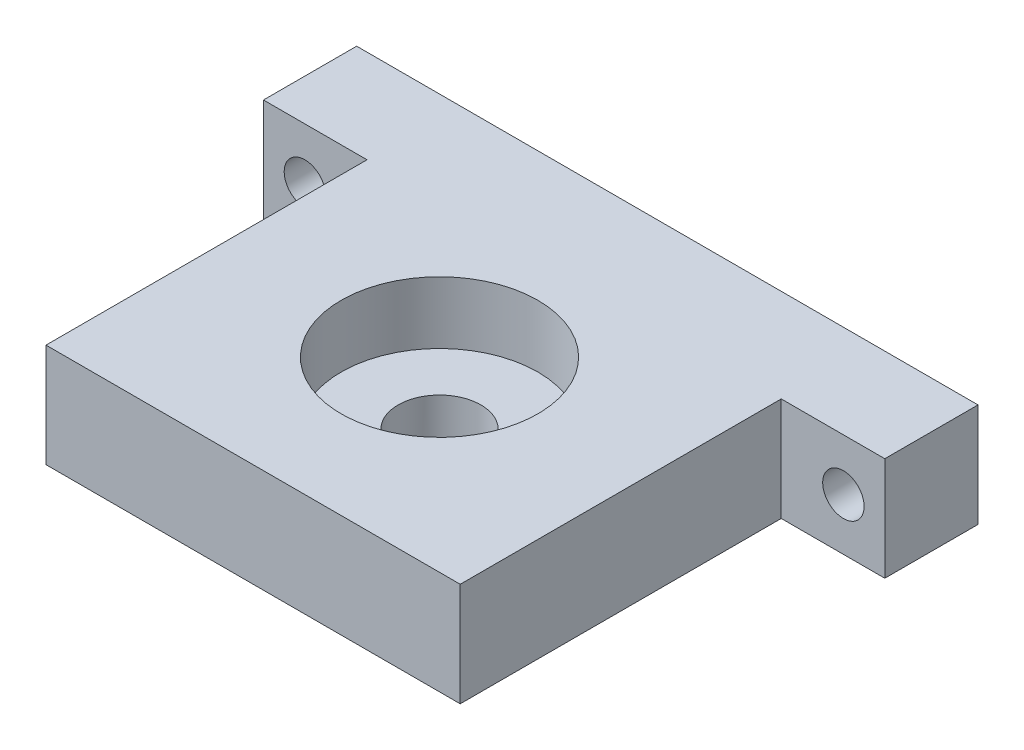
from build123d import *

# Parameters (mm, degrees)
BOSS_EXTRUDE1_DEPTH     = 10
CUT_EXTRUDE1_DEPTH      = 38.416573868
CUT_EXTRUDE1_DEPTH_BACK = 6
SKETCH3_R               = 9.5
SKETCH4_R               = 4
CUT_EXTRUDE2_DEPTH      = 10
CUT_EXTRUDE3_DEPTH      = 51.990195136
CUT_EXTRUDE3_DEPTH_BACK = 51.990195136
SKETCH5_R               = 2


with BuildPart() as part:
    # Sketch1 → Boss-Extrude1 (new body)
    with BuildSketch(Plane(origin=(0, 0, 0), x_dir=(1, 0, 0), z_dir=(0, 1, 0))):
        Polygon((-20, -20), (20, -20), (20, 11), (30, 11), (30, 20), (20, 20), (-20, 20), (-30, 20), (-30, 11), (-20, 11), align=None)
    extrude(amount=BOSS_EXTRUDE1_DEPTH)

    # Sketch3 → Cut-Extrude1 (cut, two sides: drawn at the far end of the back side and taken through both)
    with BuildSketch(Plane(origin=(0, 10, 0), x_dir=(1, 0, 0), z_dir=(0, 1, 0)).offset(-CUT_EXTRUDE1_DEPTH_BACK)):
        with Locations(Location((0, -2, 0), (0, 0, 90))):
            Circle(SKETCH3_R)
    extrude(amount=CUT_EXTRUDE1_DEPTH + CUT_EXTRUDE1_DEPTH_BACK, mode=Mode.SUBTRACT)

    # Sketch4 → Cut-Extrude2 (cut)
    with BuildSketch(Plane(origin=(0, 4, 0), x_dir=(1, 0, 0), z_dir=(0, 1, 0))):
        with Locations(Location((0, -2, 0), (0, 0, 270))):
            Circle(SKETCH4_R)
    extrude(amount=-CUT_EXTRUDE2_DEPTH, mode=Mode.SUBTRACT)

    # Sketch5 → Cut-Extrude3 (cut, two sides: drawn at the far end of the back side and taken through both)
    with BuildSketch(Plane(origin=(0, 0, -20), x_dir=(-1, 0, 0), z_dir=(0, 0, -1)).offset(-CUT_EXTRUDE3_DEPTH_BACK)):
        with Locations((-26, 5)):
            Circle(SKETCH5_R)
        with Locations((26, 5)):
            Circle(SKETCH5_R)
    extrude(amount=CUT_EXTRUDE3_DEPTH + CUT_EXTRUDE3_DEPTH_BACK, mode=Mode.SUBTRACT)


solid = part.part
